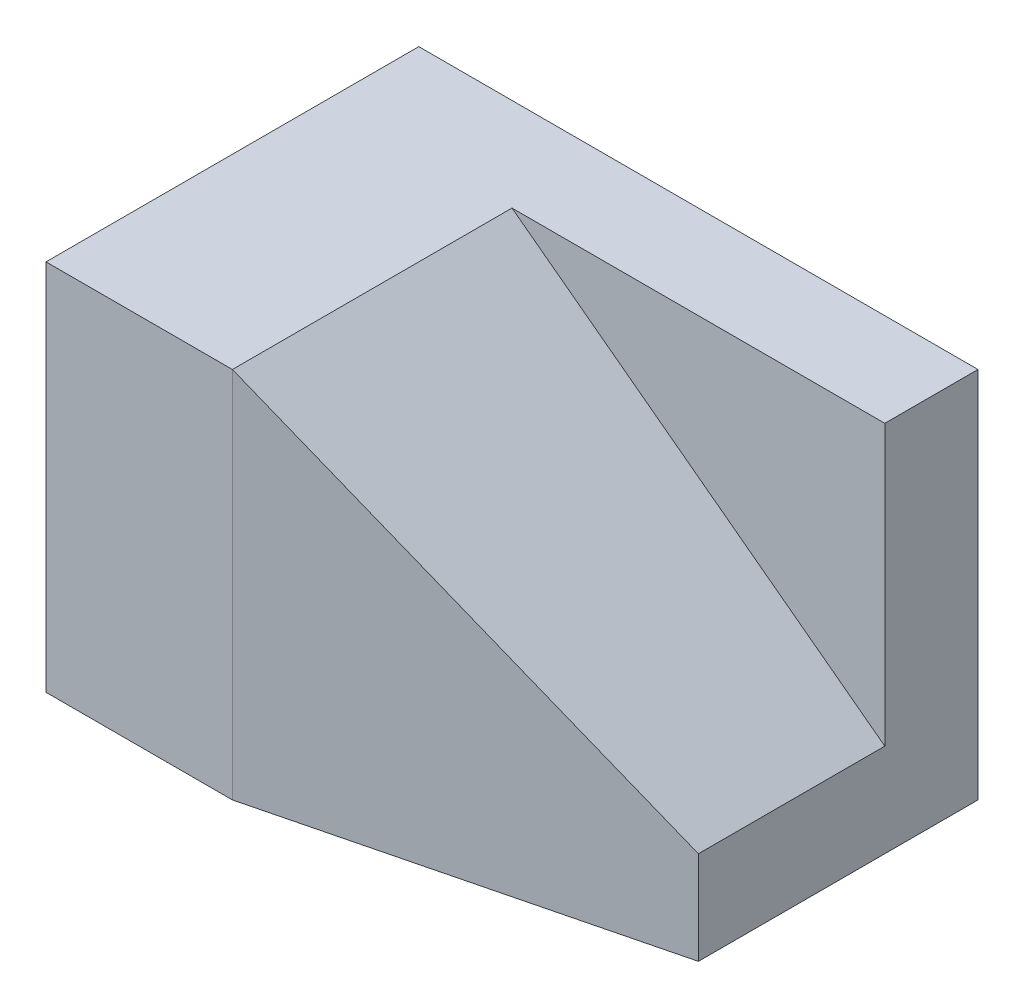
from build123d import *

# Parameters (mm, degrees)
SKETCH_1_W      = 10
SKETCH_1_H      = 15
SKETCH_1_H_2    = 5
SKETCH_1_W_2    = 20
EXTRUDE_1_DEPTH = 20


with BuildPart() as part:
    # 草圖1 → 填料-伸長1 (new body)
    with BuildSketch(Plane(origin=(0, 0, 0), x_dir=(1, 0, 0), z_dir=(0, 1, 0))):
        with Locations((5, 7.5)):
            Rectangle(SKETCH_1_W, SKETCH_1_H)
        with Locations((5, 17.5)):
            Rectangle(SKETCH_1_W, SKETCH_1_H_2)
        with Locations((20, 17.5)):
            Rectangle(SKETCH_1_W_2, SKETCH_1_H_2)
    extrude(amount=EXTRUDE_1_DEPTH)

    # 草圖4 → 疊層拉伸1 section 0
    with BuildSketch(Plane(origin=(10, 0, 0), x_dir=(0, 0, -1), z_dir=(1, 0, 0))):
        with BuildLine():
            Line((0, 0), (15, 0))
            Line((15, 0), (15, 20))
            Line((15, 20), (0, 20))
            Line((0, 20), (0, 0))
        make_face()
    # 草圖3 → 疊層拉伸1 section 1
    with BuildSketch(Plane(origin=(30, 0, 0), x_dir=(0, 0, -1), z_dir=(1, 0, 0))):
        with BuildLine():
            Line((5, 0), (15, 0))
            Line((15, 0), (15, 5))
            Line((15, 5), (5, 5))
            Line((5, 5), (5, 0))
        make_face()
    loft()


solid = part.part
